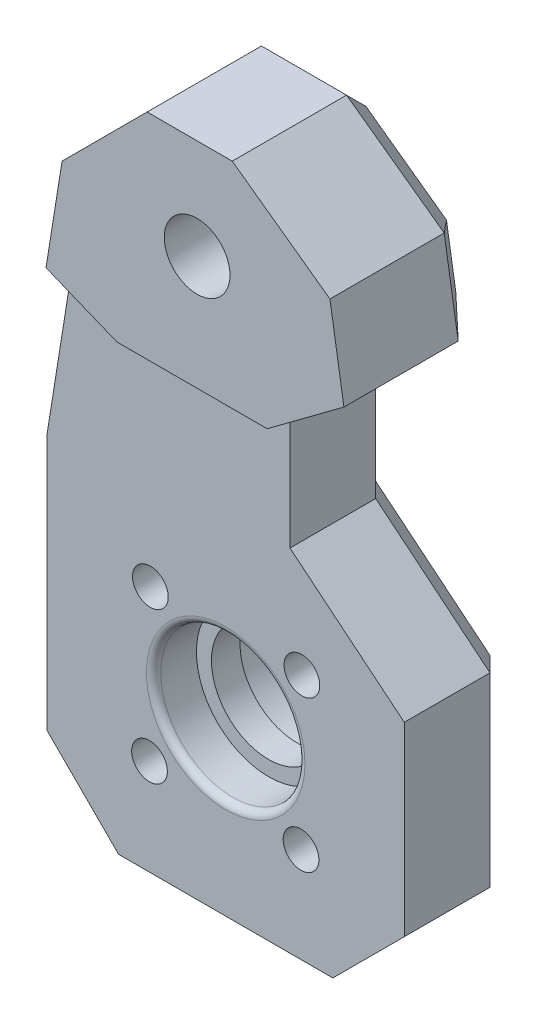
from build123d import *
from OCP.BRepFilletAPI import BRepFilletAPI_MakeChamfer

# Parameters (mm, degrees)
SKETCH_1_R          = 1.25
SKETCH_1_R_2        = 4
SKETCH_1_R_3        = 2.3
EXTRUDE_2_DEPTH     = 8
CHAMFER_1_SIZE      = 5
EXTRUDE_3_DEPTH     = 2
SKETCH_3_R          = 2.3
CUT_EXTRUDE_1_DEPTH = 7
CUT_EXTRUDE_2_DEPTH = 10
CHAMFER_2_SIZE      = 5
CHAMFER_2_SIZE2     = 6.028089953
CHAMFER_2_SIZE2_2   = 6.039479554
CHAMFER_3_SIZE      = 2
SKETCH_5_R          = 5.05
CUT_EXTRUDE_3_DEPTH = 3
CUT_EXTRUDE_START   = -3
SKETCH_6_R          = 5.05
CUT_EXTRUDE_4_DEPTH = 3
FILLET_1_R          = 0.5
SKETCH_7_R          = 4.05
CUT_EXTRUDE_5_DEPTH = 3
FILLET_2_R          = 0.5


with BuildPart() as part:
    # 草图1 → 凸台-拉伸2 (new body)
    with BuildSketch(Plane.XY):
        Polygon((8.5, 36), (12.5, 11.216882722), (12.5, -12), (-12.5, -12), (-12.5, 11), (-8.5, 36), align=None)
        with Locations((-5.273420283, 5.333014019)):
            Circle(SKETCH_1_R, mode=Mode.SUBTRACT)
        with Locations((5.333014019, 5.273420283)):
            Circle(SKETCH_1_R, mode=Mode.SUBTRACT)
        with Locations((5.273420283, -5.333014019)):
            Circle(SKETCH_1_R, mode=Mode.SUBTRACT)
        with Locations((-5.333014019, -5.273420283)):
            Circle(SKETCH_1_R, mode=Mode.SUBTRACT)
        Circle(SKETCH_1_R_2, mode=Mode.SUBTRACT)
        with Locations((0, 29)):
            Circle(SKETCH_1_R_3, mode=Mode.SUBTRACT)
    extrude(amount=EXTRUDE_2_DEPTH)

    # 倒角1
    chamfer_1_edges = [part.edges().sort_by_distance(p)[0] for p in [
        (12.5, -12, 4),
        (-12.5, -12, 4),
    ]]
    chamfer(chamfer_1_edges, length=CHAMFER_1_SIZE)

    # 草图2 → 凸台-拉伸3 (add)
    with BuildSketch(Plane.XY.offset(8)):
        Polygon((-10.577137485, 23.017890722), (-5.61376382, 21), (5.631941325, 21), (10.595314989, 23.017890722), (8.5, 36), (-8.5, 36), align=None)
    extrude(amount=EXTRUDE_3_DEPTH)

    # 草图3 → 切除-拉伸1 (cut)
    with BuildSketch(Plane(origin=(0, 0, 8), x_dir=(-1, 0, 0), z_dir=(0, 0, -1))):
        with Locations(Location((0, 29, 0), (0, 0, 180))):
            Circle(SKETCH_3_R)
    extrude(amount=-CUT_EXTRUDE_1_DEPTH, mode=Mode.SUBTRACT)

    # 草图4 → 切除-拉伸2 (cut)
    with BuildSketch(Plane(origin=(0, 0, 0), x_dir=(-1, 0, 0), z_dir=(0, 0, -1))):
        Polygon((-10.275402162, 25), (-4.5, 20.700412405), (-4.5, 12.565758544), (-12.5, 6), (-12.5, 11.216882722), align=None)
    extrude(amount=-CUT_EXTRUDE_2_DEPTH, mode=Mode.SUBTRACT)

    # 倒角2: one chamfer whose edges measure the first distance from different faces: ONE call of the kernel's chamfer builder (chamfer() names one face for all edges)
    chamfer_2_edges_1 = [part.edges().sort_by_distance(p)[0] for p in [
        (-8.5, 36, 5),
    ]]
    chamfer_2_side_1 = [part.faces().sort_by_distance(p)[0] for p in [
        (0, 36, 5),
    ]]
    chamfer_2_edges_2 = [part.edges().sort_by_distance(p)[0] for p in [
        (8.5, 36, 5),
    ]]
    chamfer_2_side_2 = [part.faces().sort_by_distance(p)[0] for p in [
        (9.387701081, 30.5, 5),
    ]]
    chamfer_2 = BRepFilletAPI_MakeChamfer(part.part.solid().wrapped)
    for e in chamfer_2_edges_1:
        chamfer_2.Add(CHAMFER_2_SIZE, CHAMFER_2_SIZE2, e.wrapped, chamfer_2_side_1[0].wrapped)  # the first distance lies on this face
    for e in chamfer_2_edges_2:
        chamfer_2.Add(CHAMFER_2_SIZE, CHAMFER_2_SIZE2_2, e.wrapped, chamfer_2_side_2[0].wrapped)  # the first distance lies on this face
    add(Compound.cast(chamfer_2.Shape()), mode=Mode.REPLACE)

    # 倒角3
    chamfer_3_edges = [part.edges().sort_by_distance(p)[0] for p in [
        (-0.519739777, 36, 0),
        (-10.976190476, 20.523809524, 0),
        (-6.476190476, 33.023809524, 0),
        (5.878605618, 33.531939841, 0),
        (0, -12, 0),
        (12.5, -0.5, 0),
        (10, -9.5, 0),
        (-10, -9.5, 0),
        (9.786046476, 28.031939841, 0),
        (-12.5, 2, 0),
        (8.5, 9.282879272, 0),
        (4.5, 16.633085475, 0),
        (7.387701081, 22.850206203, 0),
    ]]
    chamfer(chamfer_3_edges, length=CHAMFER_3_SIZE)

    # 草图5 → 切除-拉伸3 (cut)
    with BuildSketch(Plane(origin=(0, 0, 0), x_dir=(-1, 0, 0), z_dir=(0, 0, -1))):
        Circle(SKETCH_5_R)
    extrude(amount=-CUT_EXTRUDE_3_DEPTH, mode=Mode.SUBTRACT)

    # 草图6 → 切除-拉伸4 (cut)
    with BuildSketch(Plane.XY.offset(8).offset(CUT_EXTRUDE_START)):
        with Locations(Location((0, 0, 0), (0, 0, 180))):
            Circle(SKETCH_6_R)
    extrude(amount=CUT_EXTRUDE_4_DEPTH, mode=Mode.SUBTRACT)

    # 圆角1
    fillet_1_edges = [part.edges().sort_by_distance(p)[0] for p in [
        (5.05, 0, 0),
        (5.05, 0, 8),
    ]]
    fillet(fillet_1_edges, radius=FILLET_1_R)

    # 草图7 → 切除-拉伸5 (cut)
    with BuildSketch(Plane(origin=(0, 0, 0), x_dir=(-1, 0, 0), z_dir=(0, 0, -1))):
        with Locations((0, 29)):
            Circle(SKETCH_7_R)
    extrude(amount=-CUT_EXTRUDE_5_DEPTH, mode=Mode.SUBTRACT)

    # 圆角2
    fillet_2_edges = [part.edges().sort_by_distance(p)[0] for p in [
        (4.05, 29, 0),
    ]]
    fillet(fillet_2_edges, radius=FILLET_2_R)


solid = part.part
